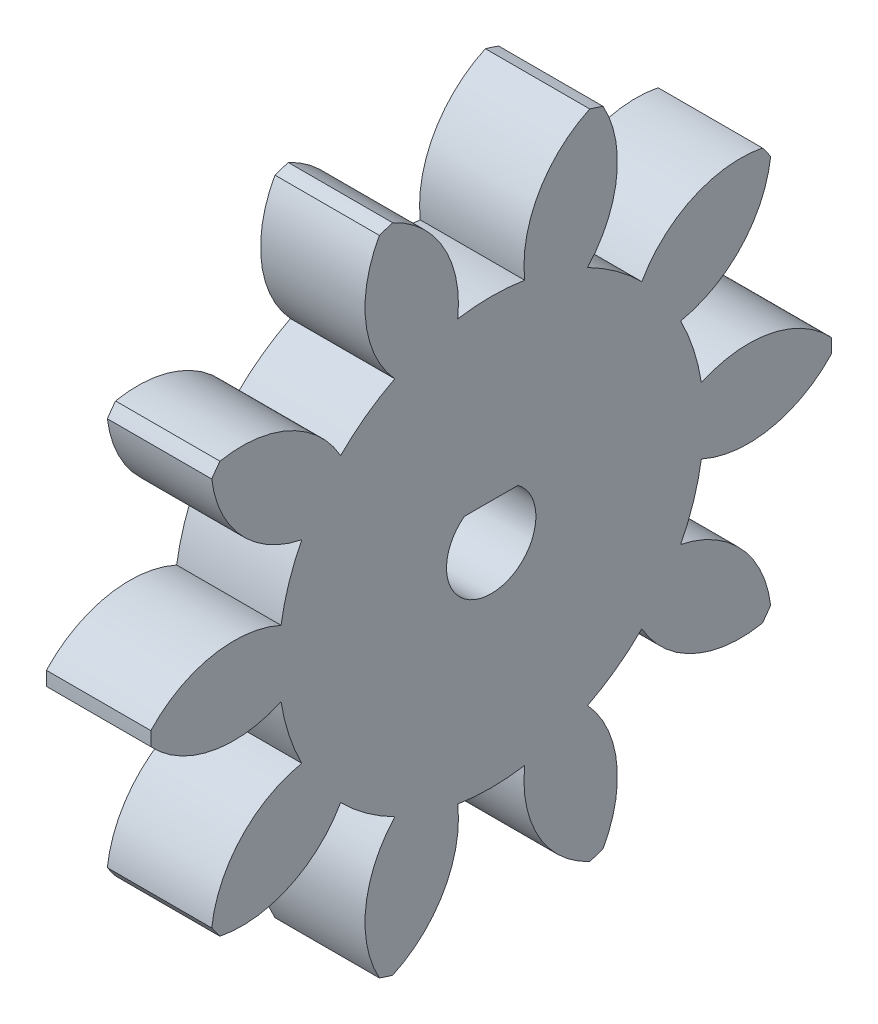
from build123d import *

# Parameters (mm, degrees)
BASPROSKE_W         = 5.842
BASPROSKE_H         = 19.05
TOOTHCUT_DEPTH      = 28.566899789
TEETHCUTS_COUNT     = 10
TEETHCUTS_ANGLE     = 324
BORSKE_R            = 2.38125
BORE_DEPTH          = 50.8000508
SKETCH1_R           = 2.5
CUT_EXTRUDE1_DEPTH  = 5.842
BOSS_EXTRUDE1_DEPTH = 5.842


with BuildPart() as part:
    # BasProSke → Base-Revolve (revolve)
    with BuildSketch(Plane(origin=(0, 0, 0), x_dir=(1, 0, 0), z_dir=(0, 1, 0)), mode=Mode.PRIVATE) as base_revolve_sk:
        with Locations((2.921, 9.525)):
            Rectangle(BASPROSKE_W, BASPROSKE_H)
    revolve(base_revolve_sk.sketch.rotate(Axis((-10, 0, 0), (1, 0, 0)), 180), axis=Axis((-10, 0, 0), (1, 0, 0)))

    # TooCutSke → ToothCut (cut, through all)
    with BuildSketch(Plane(origin=(0, 0, 0), x_dir=(0, 0, -1), z_dir=(1, 0, 0))):
        with BuildLine():
            ThreePointArc((1.873548596, 11.756630659), (0, 11.90498), (-1.873548596, 11.756630659))
            ThreePointArc((-1.873548596, 11.756630659), (-2.656568084, 15.60034376), (-5.548507123, 18.250615164))
            ThreePointArc((-5.548507123, 18.250615164), (0, 19.0754), (5.548507123, 18.250615164))
            ThreePointArc((5.548507123, 18.250615164), (2.656568084, 15.60034376), (1.873548596, 11.756630659))
        make_face()
    toothcut = extrude(amount=TOOTHCUT_DEPTH, mode=Mode.SUBTRACT)

    # TeethCuts: ToothCut ×10 about axis
    teethcuts_axis = Axis((-10, 0, 0), (1, 0, 0))
    for i in range(1, TEETHCUTS_COUNT):
        add(toothcut.rotate(teethcuts_axis, i * TEETHCUTS_ANGLE / (TEETHCUTS_COUNT - 1)), mode=Mode.SUBTRACT)

    # BorSke → Bore (cut, symmetric)
    with BuildSketch(Plane(origin=(0, 0, 0), x_dir=(0, 0, -1), z_dir=(1, 0, 0))):
        with Locations(Location((0, 0, 0), (0, 0, 180))):
            Circle(BORSKE_R)
    extrude(amount=BORE_DEPTH, both=True, mode=Mode.SUBTRACT)

    # Sketch1 → Cut-Extrude1 (cut)
    with BuildSketch(Plane(origin=(5.842, 0, 0), x_dir=(0, 0, -1), z_dir=(1, 0, 0))):
        Circle(SKETCH1_R)
    extrude(amount=-CUT_EXTRUDE1_DEPTH, mode=Mode.SUBTRACT)

    # Sketch2 → Boss-Extrude1 (add)
    with BuildSketch(Plane(origin=(5.842, 0, 0), x_dir=(0, 0, -1), z_dir=(1, 0, 0))):
        with BuildLine():
            Line((-1.5, 2), (1.5, 2))
            ThreePointArc((1.5, 2), (0, 2.5), (-1.5, 2))
        make_face()
    extrude(amount=-BOSS_EXTRUDE1_DEPTH)


solid = part.part
